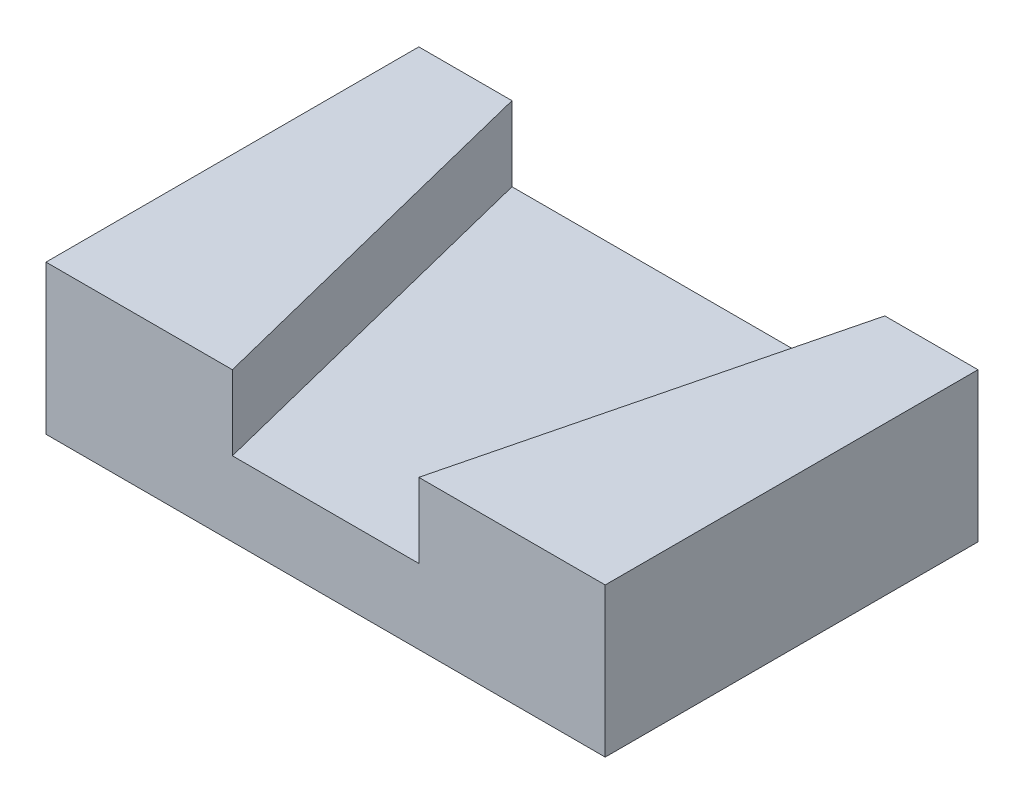
from build123d import *

# Parameters (mm, degrees)
SKETCH1_W           = 150
SKETCH1_H           = 100
BOSS_EXTRUDE1_DEPTH = 40
CUT_EXTRUDE1_DEPTH  = 20


with BuildPart() as part:
    # Sketch1 → Boss-Extrude1 (new body)
    with BuildSketch(Plane(origin=(0, 0, 0), x_dir=(1, 0, 0), z_dir=(0, 1, 0))):
        Rectangle(SKETCH1_W, SKETCH1_H)
    extrude(amount=BOSS_EXTRUDE1_DEPTH)

    # Sketch2 → Cut-Extrude1 (cut)
    with BuildSketch(Plane(origin=(0, 40, 0), x_dir=(1, 0, 0), z_dir=(0, 1, 0))):
        Polygon((-50, 50), (-25, -50), (25, -50), (50, 50), align=None)
    extrude(amount=-CUT_EXTRUDE1_DEPTH, mode=Mode.SUBTRACT)


solid = part.part
